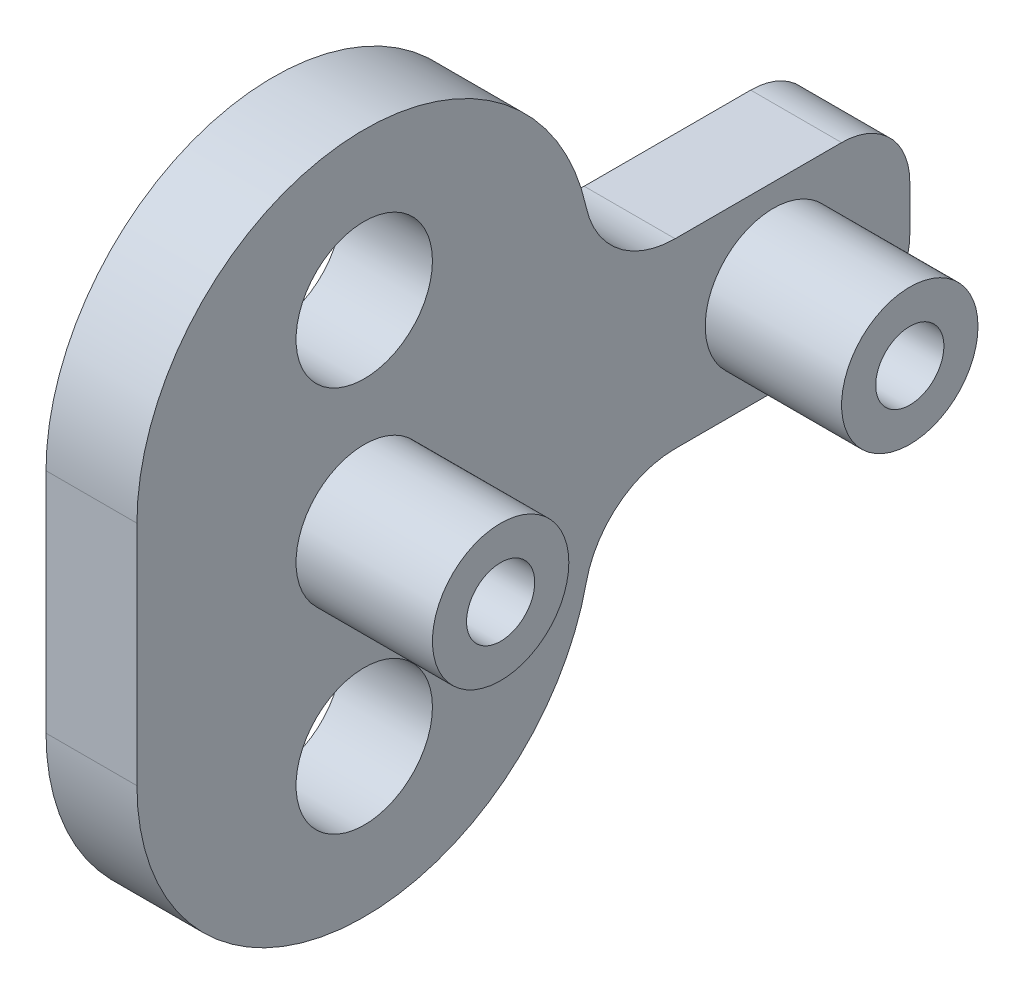
from build123d import *

# Parameters (mm, degrees)
BOSS_EXTRUDE1_DEPTH      = 4
SKETCH2_W                = 6
SKETCH2_H                = 3
SKETCH3_W                = 6
SKETCH3_H                = 3
F_3_0_3_DIAMETER_HOLE1_D = 3
F_6_0_6_DIAMETER_HOLE1_D = 6
FILLET1_R                = 3
FILLET2_R                = 4


with BuildPart() as part:
    # Sketch1 → Boss-Extrude1 (new body)
    with BuildSketch(Plane(origin=(24, 0, 0), x_dir=(0, 0, -1), z_dir=(1, 0, 0))):
        with BuildLine():
            Line((-96.043137062, 96.972273827), (-110.093262691, 96.972273827))
            ThreePointArc((-110.093262691, 96.972273827), (-119.542509311, 107.959734558), (-130.043137062, 97.972273827))
            Line((-130.043137062, 97.972273827), (-130.043137062, 87.972273827))
            ThreePointArc((-130.043137062, 87.972273827), (-119.542509311, 77.984813095), (-110.093262691, 88.972273827))
            Line((-110.093262691, 88.972273827), (-96.043137062, 88.972273827))
            Line((-96.043137062, 88.972273827), (-96.043137062, 96.972273827))
        make_face()
    extrude(amount=-BOSS_EXTRUDE1_DEPTH)

    # Sketch2 → Revolve1 (revolve)
    with BuildSketch(Plane.XY.offset(102.043137062), mode=Mode.PRIVATE) as revolve1_sk:
        with Locations((27, 94.472273827)):
            Rectangle(SKETCH2_W, SKETCH2_H)
    revolve(revolve1_sk.sketch.rotate(Axis((24, 92.972273827, 102.043137062), (1, 0, 0)), 270), axis=Axis((24, 92.972273827, 102.043137062), (1, 0, 0)))

    # Sketch3 → Revolve2 (revolve)
    with BuildSketch(Plane.XY.offset(120.043137062), mode=Mode.PRIVATE) as revolve2_sk:
        with Locations((27, 94.472273827)):
            Rectangle(SKETCH3_W, SKETCH3_H)
    revolve(revolve2_sk.sketch.rotate(Axis((24, 92.972273827, 120.043137062), (1, 0, 0)), 270), axis=Axis((24, 92.972273827, 120.043137062), (1, 0, 0)))

    # Ø3.0 (3) Diameter Hole1 (through all)
    with Locations(Plane(origin=(30, 0, 0), x_dir=(0, 0, -1), z_dir=(1, 0, 0))):
        with Locations((-120.043137062, 92.972273827), (-102.043137062, 92.972273827)):
            Hole(F_3_0_3_DIAMETER_HOLE1_D / 2)

    # Ø6.0 (6) Diameter Hole1 (through all)
    with Locations(Plane(origin=(24, 0, 0), x_dir=(0, 0, -1), z_dir=(1, 0, 0))):
        with Locations((-120.043137062, 101.472273827), (-120.043137062, 84.472273827)):
            Hole(F_6_0_6_DIAMETER_HOLE1_D / 2)

    # Fillet1
    fillet1_edges = [part.edges().sort_by_distance(p)[0] for p in [
        (22, 88.972273827, 96.043137062),
        (22, 96.972273827, 96.043137062),
    ]]
    fillet(fillet1_edges, radius=FILLET1_R)

    # Fillet2
    fillet2_edges = [part.edges().sort_by_distance(p)[0] for p in [
        (22, 88.972273827, 110.093262691),
        (22, 96.972273827, 110.093262691),
    ]]
    fillet(fillet2_edges, radius=FILLET2_R)


solid = part.part
